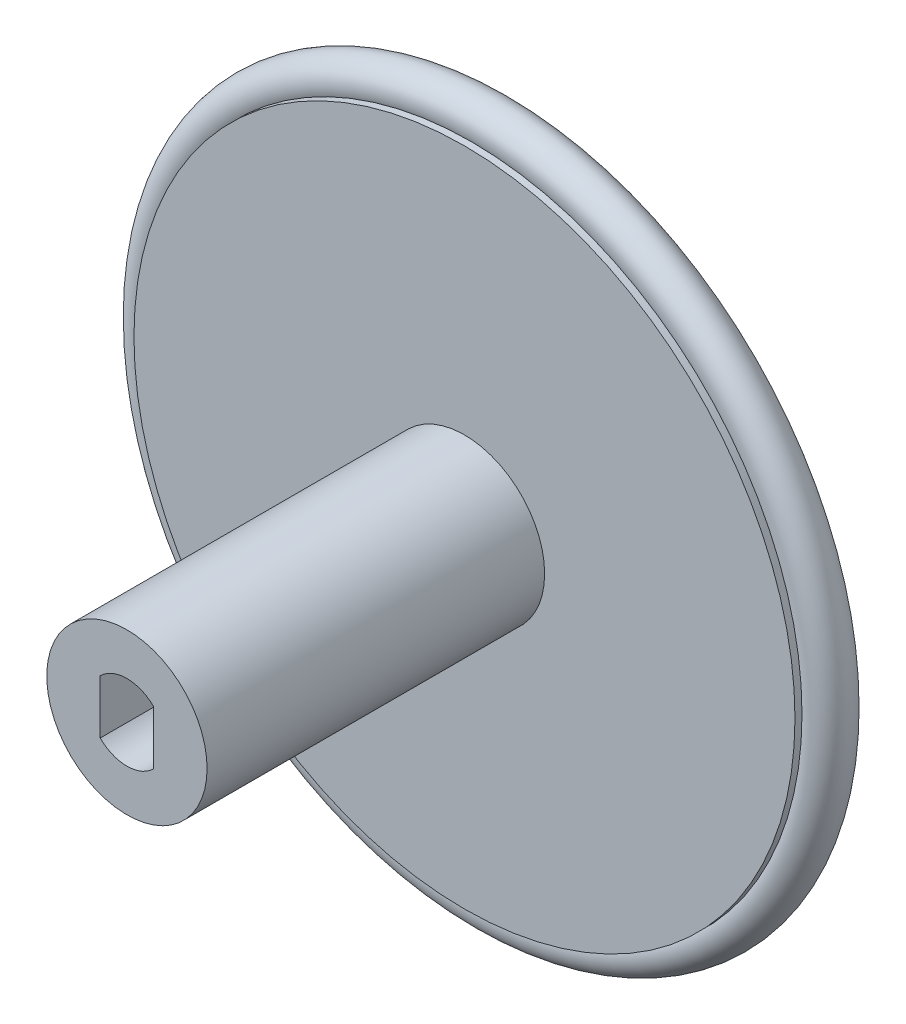
from build123d import *

# Parameters (mm, degrees)
CROQUIS3_R              = 5.7
SALIENTE_EXTRUIR2_DEPTH = 24
SALIENTE_EXTRUIR3_REACH = 50.328
SALIENTE_EXTRUIR3_START = -5
CROQUIS5_R              = 1.5


with BuildPart() as part:
    # Croquis1 → Revolución1 (revolve)
    with BuildSketch(Plane(origin=(0, 0, 0), x_dir=(0, 0, -1), z_dir=(1, 0, 0)), mode=Mode.PRIVATE) as revoluci_n1_sk:
        Polygon((-1.9, 0), (-1.9, 23.5), (-1.4, 23.5), (-0.5, 21.000153831), (0.5, 21.000153831), (1.4, 23.5), (1.9, 23.5), (1.9, 0), align=None)
    revolve(revoluci_n1_sk.sketch.rotate(Axis((0, 0, -6.227056579), (0, 0, 1)), 90), axis=Axis((0, 0, -6.227056579), (0, 0, 1)))

    # Croquis3 → Saliente-Extruir2 (add)
    with BuildSketch(Plane.XY.offset(1.9)):
        Circle(CROQUIS3_R)
        with BuildLine():
            Line((-1.9, 1.918332609), (-1.9, -1.918332609))
            ThreePointArc((-1.9, -1.918332609), (0, -2.7), (1.9, -1.918332609))
            Line((1.9, -1.918332609), (1.9, 1.918332609))
            ThreePointArc((1.9, 1.918332609), (0, 2.7), (-1.9, 1.918332609))
        make_face(mode=Mode.SUBTRACT)
    extrude(amount=SALIENTE_EXTRUIR2_DEPTH)

    # Croquis4 → Saliente-Extruir3 (add, up to next)
    with BuildSketch(Plane.XY.offset(25.9).offset(SALIENTE_EXTRUIR3_START), mode=Mode.PRIVATE) as saliente_extruir3_sk1:
        with BuildLine():
            Line((-1.9, 1.918332609), (-1.9, -1.918332609))
            ThreePointArc((-1.9, -1.918332609), (0, -2.7), (1.9, -1.918332609))
            Line((1.9, -1.918332609), (1.9, 1.918332609))
            ThreePointArc((1.9, 1.918332609), (0, 2.7), (-1.9, 1.918332609))
        make_face()
    saliente_extruir3_tool1 = extrude(saliente_extruir3_sk1.sketch, amount=-SALIENTE_EXTRUIR3_REACH, mode=Mode.PRIVATE) - part.part
    add(saliente_extruir3_tool1.solids().sort_by_distance((0, 0, 20.9))[0])


with BuildPart() as body_2:
    # Croquis5 → Revolución2 (revolve)
    with BuildSketch(Plane(origin=(0, 0, 0), x_dir=(0, 0, -1), z_dir=(1, 0, 0)), mode=Mode.PRIVATE) as revoluci_n2_sk:
        with Locations((0, 24.039552594)):
            Circle(CROQUIS5_R)
    revolve(revoluci_n2_sk.sketch.rotate(Axis((0, 0, 9.093206655), (0, 0, -1)), 90), axis=Axis((0, 0, 9.093206655), (0, 0, -1)))


solid = Compound([part.part, body_2.part])
